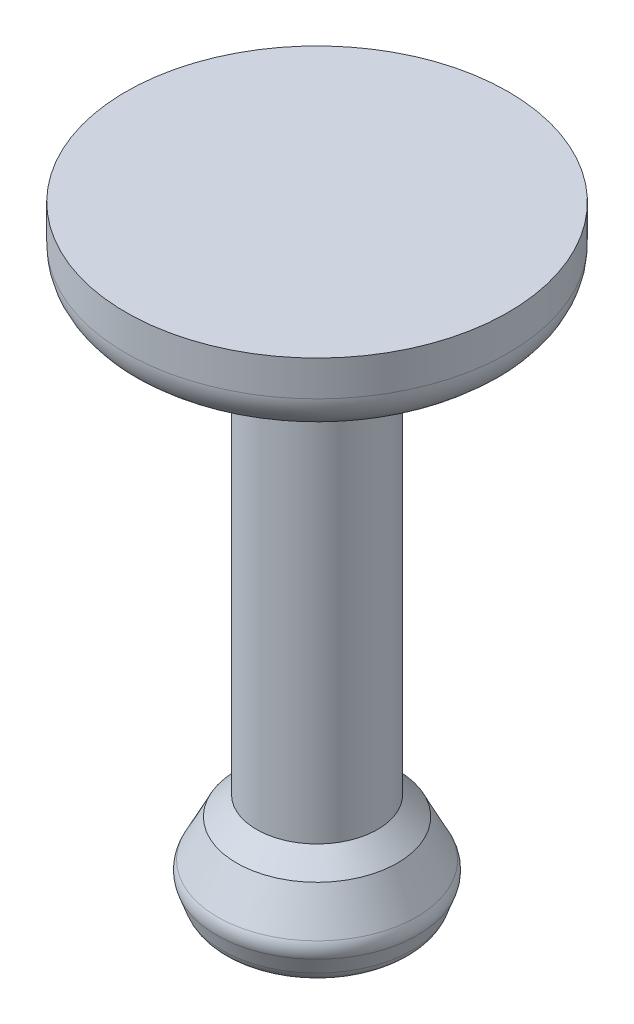
from build123d import *


with BuildPart() as part:
    # Sketch1 → Revolve3 (revolve)
    with BuildSketch(Plane.XY, mode=Mode.PRIVATE) as revolve3_sk:
        with BuildLine():
            Line((-20.400236636, 14.424908344), (-20.400236636, -0.261393937))
            Line((-20.400236636, -0.261393937), (-21.719162522, -1.530451169))
            Line((-21.719162522, -1.530451169), (-22.980158849, -4.004592346))
            ThreePointArc((-22.980158849, -4.004592346), (-23.116228268, -4.502948705), (-23.042560909, -5.014267655))
            Line((-23.042560909, -5.014267655), (-22.653341709, -6.087520982))
            ThreePointArc((-22.653341709, -6.087520982), (-22.188474627, -6.694443039), (-21.459427679, -6.924543742))
            Line((-21.459427679, -6.924543742), (-19.4537368, -6.924543742))
            Line((-19.4537368, -6.924543742), (-20.15067284, -5.68654307))
            ThreePointArc((-20.15067284, -5.68654307), (-20.308987647, -5.1760969), (-20.243290857, -4.645717034))
            Line((-20.243290857, -4.645717034), (-19.985241777, -3.90500514))
            ThreePointArc((-19.985241777, -3.90500514), (-19.52155814, -3.287559507), (-18.785937053, -3.05281871))
            Line((-18.785937053, -3.05281871), (-16.386357218, -3.05281871))
            Line((-16.386357218, -3.05281871), (-16.386357218, 33.77718129))
            Line((-16.386357218, 33.77718129), (-29.06595701, 33.77718129))
            Line((-29.06595701, 33.77718129), (-29.06595701, 31.432997969))
            ThreePointArc((-29.06595701, 31.432997969), (-28.454196627, 29.779670421), (-26.91360112, 28.922752554))
            Line((-26.91360112, 28.922752554), (-22.552592527, 28.249304737))
            ThreePointArc((-22.552592527, 28.249304737), (-21.01199702, 27.39238687), (-20.400236636, 25.739059322))
            Line((-20.400236636, 25.739059322), (-20.400236636, 14.424908344))
        make_face()
    revolve(revolve3_sk.sketch.rotate(Axis((-16.386357218, -3.05281871, 0), (0, 1, 0)), 270), axis=Axis((-16.386357218, -3.05281871, 0), (0, 1, 0)))


solid = part.part
